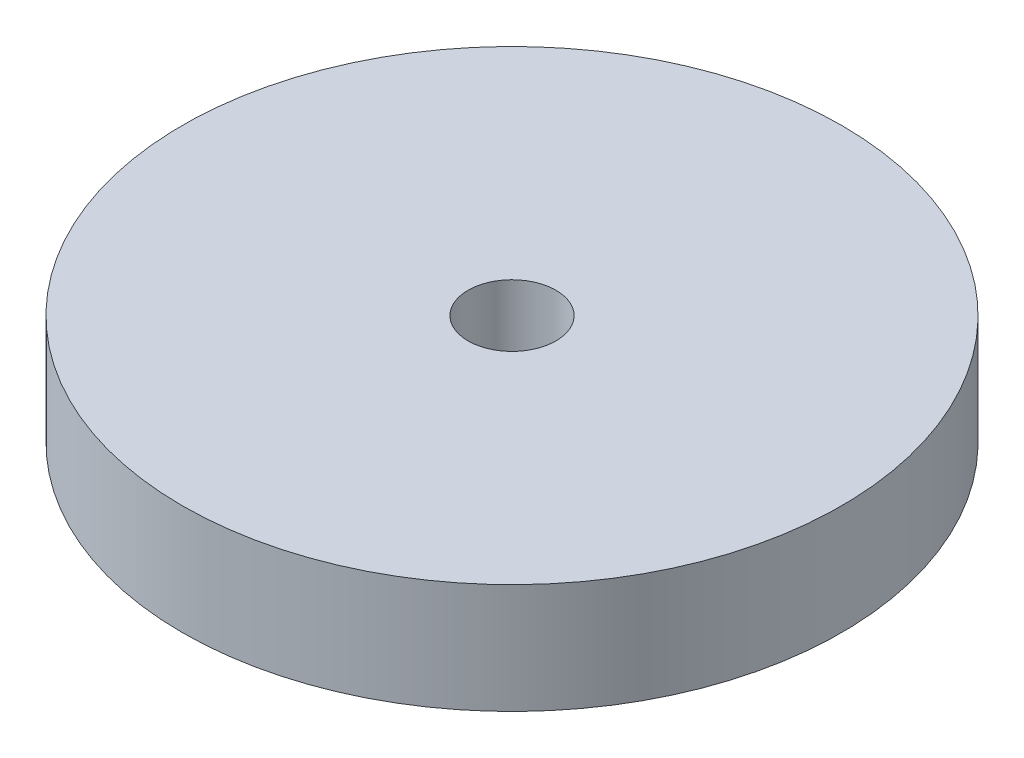
from build123d import *

# Parameters (mm, degrees)
SKETCH_1_R      = 15
SKETCH_1_R_2    = 2
EXTRUDE_1_DEPTH = 5


with BuildPart() as part:
    # 草图1 → 凸台-拉伸1 (new body)
    with BuildSketch(Plane(origin=(0, 0, 0), x_dir=(1, 0, 0), z_dir=(0, 1, 0))):
        with Locations(Location((0, 0, 0), (0, 0, 270))):
            Circle(SKETCH_1_R)
        with Locations(Location((0, 0, 0), (0, 0, 270))):
            Circle(SKETCH_1_R_2, mode=Mode.SUBTRACT)
    extrude(amount=EXTRUDE_1_DEPTH)


solid = part.part
